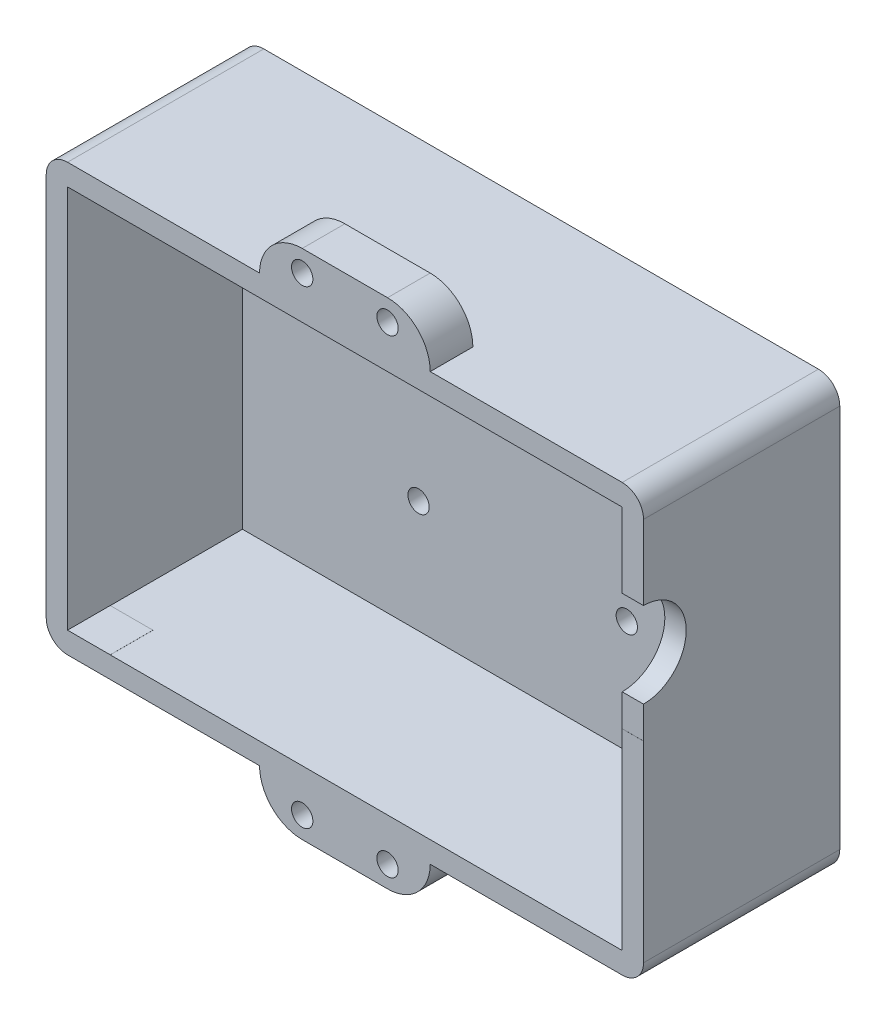
from build123d import *

# Parameters (mm, degrees)
SKETCH1_W            = 76.2
SKETCH1_H            = 63.5
BOSS_EXTRUDE1_DEPTH  = 31.75
SKETCH2_W            = 69.85
SKETCH2_H            = 57.15
CUT_EXTRUDE1_DEPTH   = 28.575
SKETCH3_W            = 19.05
SKETCH3_H            = 25.4
CUT_EXTRUDE2_DEPTH   = 28.575
SKETCH4_R            = 1.5875
SKETCH4_W            = 19.05
SKETCH4_H            = 6.35
CUT_EXTRUDE3_DEPTH   = 28.575
SKETCH5_W            = 19.05
SKETCH5_H            = 6.35
CUT_EXTRUDE4_DEPTH   = 28.575
SKETCH7_W            = 25.4
SKETCH7_H            = 6.35
BOSS_EXTRUDE2_DEPTH  = 6.35
SKETCH9_R            = 1.5875
CUT_EXTRUDE5_DEPTH   = 6.35
SKETCH10_W           = 25.4
SKETCH10_H           = 6.35
BOSS_EXTRUDE3_DEPTH  = 6.35
SKETCH11_R           = 1.5875
CUT_EXTRUDE6_DEPTH   = 6.35
SKETCH12_R           = 6.35
CUT_EXTRUDE8_DEPTH   = 6.35
SKETCH13_W           = 7.178118798
SKETCH13_H           = 13.595140403
BOSS_EXTRUDE4_DEPTH  = 3.175
SKETCH14_R           = 6.35
CUT_EXTRUDE9_DEPTH   = 3.175
SKETCH15_R           = 1.5875
BOSS_EXTRUDE8_DEPTH  = 3.175
SKETCH16_R           = 1.5875
CUT_EXTRUDE11_DEPTH  = 8.509
CUT_EXTRUDE12_DEPTH  = 8.509
SKETCH26_R           = 2.921
CUT_EXTRUDE24_DEPTH  = 72.898
SKETCH32_W           = 69.85
SKETCH32_H           = 57.15
SKETCH32_R           = 2.921
BOSS_EXTRUDE10_DEPTH = 5.715
SKETCH36_W           = 34.13125
SKETCH36_H           = 28.575
CUT_EXTRUDE27_DEPTH  = 38.227
CUT_EXTRUDE29_DEPTH  = 38.227
SKETCH39_W           = 17.907
SKETCH39_H           = 57.15
SKETCH39_R           = 1.905
SKETCH39_W_2         = 17.81175
BOSS_EXTRUDE11_DEPTH = 2.54
CUT_EXTRUDE34_DEPTH  = 11.176
SKETCH47_W           = 34.544
SKETCH47_H           = 45.212
CUT_EXTRUDE36_DEPTH  = 11.43
SKETCH51_W           = 31.75
SKETCH51_H           = 63.5
BOSS_EXTRUDE16_DEPTH = 6.35
SKETCH52_W           = 31.75
SKETCH52_H           = 63.5
BOSS_EXTRUDE17_DEPTH = 6.35
CUT_EXTRUDE37_START  = -6.35
SKETCH53_R           = 6.35
CUT_EXTRUDE37_DEPTH  = 6.35
SKETCH54_W           = 6.35
SKETCH54_H           = 57.013513642
SKETCH54_H_2         = 57.15
CUT_EXTRUDE38_DEPTH  = 21.59
SKETCH57_W           = 6.35
SKETCH57_H           = 57.15
BOSS_EXTRUDE20_DEPTH = 1.27
SKETCH59_W           = 16.847295719
SKETCH59_H           = 36.06156687
SKETCH59_W_2         = 16.70806187
SKETCH59_H_2         = 36.618502265
BOSS_EXTRUDE21_DEPTH = 11.43
SKETCH61_R           = 2.921
CUT_EXTRUDE39_DEPTH  = 8.89
SKETCH62_R           = 1.905
CUT_EXTRUDE40_DEPTH  = 2.54
SKETCH64_W           = 6.35
SKETCH64_H           = 20.32
CUT_EXTRUDE42_DEPTH  = 0.127
SKETCH63_W           = 1.27
SKETCH63_H           = 57.013513642
SKETCH63_W_2         = 3.81
BOSS_EXTRUDE22_DEPTH = 83.439
SKETCH65_R           = 1.5875
CUT_EXTRUDE43_DEPTH  = 83.439
SKETCH66_W           = 25.4
SKETCH66_H           = 38.1
CUT_EXTRUDE44_DEPTH  = 83.439
BOSS_EXTRUDE23_DEPTH = 11.43
CUT_EXTRUDE45_DEPTH  = 11.43
CUT_EXTRUDE47_DEPTH  = 63.5
SKETCH72_R           = 6.35
CUT_EXTRUDE48_DEPTH  = 63.5
SKETCH73_W           = 7.89440902
SKETCH73_H           = 12.7
BOSS_EXTRUDE24_DEPTH = 3.175
CUT_EXTRUDE49_DEPTH  = 9.779
CUT_EXTRUDE50_DEPTH  = 9.779
CUT_EXTRUDE51_DEPTH  = 9.779
SKETCH81_W           = 3.243342167
SKETCH81_H           = 0.034482981
CUT_EXTRUDE52_DEPTH  = 36.703
SKETCH85_R           = 2.921
CUT_EXTRUDE53_DEPTH  = 11.43
SKETCH86_W           = 82.55
SKETCH86_H           = 57.15
SKETCH86_R           = 1.905
BOSS_EXTRUDE28_DEPTH = 2.54
CUT_EXTRUDE54_START  = -38.862
SKETCH87_R           = 1.5875
SKETCH87_W           = 25.330152682
SKETCH87_H           = 38.1
CUT_EXTRUDE54_DEPTH  = 38.862
SKETCH88_W           = 34.544
SKETCH88_H           = 38.1
SKETCH88_W_2         = 31.147363918
SKETCH88_H_2         = 3.556
CUT_EXTRUDE55_DEPTH  = 2.54
CUT_EXTRUDE56_DEPTH  = 2.54
CUT_EXTRUDE57_DEPTH  = 2.54
BOSS_EXTRUDE30_START = -7.62
SKETCH92_W           = 82.55
SKETCH92_H           = 57.15
SKETCH92_R           = 1.5875
SKETCH92_W_2         = 25.4
SKETCH92_H_2         = 38.1
BOSS_EXTRUDE30_DEPTH = 7.62
SKETCH93_W           = 82.55
SKETCH93_H           = 57.15
CUT_EXTRUDE58_DEPTH  = 2.54
SKETCH94_W           = 82.55
SKETCH94_H           = 57.15
CUT_EXTRUDE59_DEPTH  = 32.004
SKETCH95_W           = 86.575346052
SKETCH95_H           = 60.338226315
BOSS_EXTRUDE31_DEPTH = 5.715
SKETCH96_W           = 93.509952632
SKETCH96_H           = 68.488176315
CUT_EXTRUDE60_DEPTH  = 2.54
CUT_EXTRUDE61_START  = -10.668
SKETCH97_R           = 6.35
CUT_EXTRUDE61_DEPTH  = 10.668
SKETCH98_W           = 10.458534211
SKETCH98_H           = 15.345159211
BOSS_EXTRUDE32_DEPTH = 3.175
SKETCH99_R           = 1.5875
CUT_EXTRUDE62_DEPTH  = 25.527
SKETCH100_W          = 8.061009101
SKETCH100_H          = 12.695256821
BOSS_EXTRUDE33_DEPTH = 3.175
SKETCH103_R          = 6.35
CUT_EXTRUDE63_DEPTH  = 3.175


with BuildPart() as part:
    # Sketch1 → Boss-Extrude1 (new body)
    with BuildSketch(Plane.XY):
        with Locations((38.1, -31.75)):
            Rectangle(SKETCH1_W, SKETCH1_H)
    extrude(amount=BOSS_EXTRUDE1_DEPTH)

    # Sketch2 → Cut-Extrude1 (cut)
    with BuildSketch(Plane.XY.offset(31.75)):
        with Locations((38.1, -31.75)):
            Rectangle(SKETCH2_W, SKETCH2_H)
    extrude(amount=-CUT_EXTRUDE1_DEPTH, mode=Mode.SUBTRACT)

    # Sketch3 → Cut-Extrude2 (cut)
    with BuildSketch(Plane(origin=(0, 0, 0), x_dir=(-1, 0, 0), z_dir=(0, 0, -1))):
        with Locations((-38.1, -31.75)):
            Rectangle(SKETCH3_W, SKETCH3_H)
    extrude(amount=-CUT_EXTRUDE2_DEPTH, mode=Mode.SUBTRACT)

    # Sketch4 → Cut-Extrude3 (cut)
    with BuildSketch(Plane(origin=(0, 0, 0), x_dir=(-1, 0, 0), z_dir=(0, 0, -1))):
        with Locations((-52.03825, -19.05)):
            Circle(SKETCH4_R)
        with Locations((-24.257, -19.05)):
            Circle(SKETCH4_R)
        with Locations((-52.038249991, -44.45)):
            Circle(SKETCH4_R)
        with Locations((-24.257, -44.45)):
            Circle(SKETCH4_R)
        with Locations((-38.1, -15.875)):
            Rectangle(SKETCH4_W, SKETCH4_H)
    extrude(amount=-CUT_EXTRUDE3_DEPTH, mode=Mode.SUBTRACT)

    # Sketch5 → Cut-Extrude4 (cut)
    with BuildSketch(Plane(origin=(0, 0, 0), x_dir=(-1, 0, 0), z_dir=(0, 0, -1))):
        with Locations((-38.1, -47.625)):
            Rectangle(SKETCH5_W, SKETCH5_H)
    extrude(amount=-CUT_EXTRUDE4_DEPTH, mode=Mode.SUBTRACT)

    # Sketch7 → Boss-Extrude2 (add)
    with BuildSketch(Plane(origin=(0, 0, 0), x_dir=(1, 0, 0), z_dir=(0, 1, 0))):
        with Locations((38.1, -28.575)):
            Rectangle(SKETCH7_W, SKETCH7_H)
    extrude(amount=BOSS_EXTRUDE2_DEPTH)

    # Sketch9 → Cut-Extrude5 (cut)
    with BuildSketch(Plane(origin=(0, 0, 25.4), x_dir=(-1, 0, 0), z_dir=(0, 0, -1))):
        with Locations((-44.45, 3.175)):
            Circle(SKETCH9_R)
        with Locations((-31.75, 3.175)):
            Circle(SKETCH9_R)
    extrude(amount=-CUT_EXTRUDE5_DEPTH, mode=Mode.SUBTRACT)

    # Sketch10 → Boss-Extrude3 (add)
    with BuildSketch(Plane.XZ.offset(63.5)):
        with Locations((38.1, 28.575)):
            Rectangle(SKETCH10_W, SKETCH10_H)
    extrude(amount=BOSS_EXTRUDE3_DEPTH)

    # Sketch11 → Cut-Extrude6 (cut)
    with BuildSketch(Plane(origin=(0, 0, 25.4), x_dir=(-1, 0, 0), z_dir=(0, 0, -1))):
        with Locations((-44.45, -66.675)):
            Circle(SKETCH11_R)
        with Locations((-31.75, -66.675)):
            Circle(SKETCH11_R)
    extrude(amount=-CUT_EXTRUDE6_DEPTH, mode=Mode.SUBTRACT)

    # Sketch12 → Cut-Extrude8 (cut)
    with BuildSketch(Plane(origin=(76.2, 0, 0), x_dir=(0, 0, -1), z_dir=(1, 0, 0))):
        with Locations((-31.75, -28.575)):
            Circle(SKETCH12_R)
    extrude(amount=-CUT_EXTRUDE8_DEPTH, mode=Mode.SUBTRACT)

    # Sketch13 → Boss-Extrude4 (add)
    with BuildSketch(Plane(origin=(76.2, 0, 0), x_dir=(0, 0, -1), z_dir=(1, 0, 0))):
        with Locations((-28.160940601, -29.022570202)):
            Rectangle(SKETCH13_W, SKETCH13_H)
    extrude(amount=-BOSS_EXTRUDE4_DEPTH)

    # Sketch14 → Cut-Extrude9 (cut)
    with BuildSketch(Plane(origin=(76.2, 0, 0), x_dir=(0, 0, -1), z_dir=(1, 0, 0))):
        with Locations((-31.75, -25.4)):
            Circle(SKETCH14_R)
    extrude(amount=-CUT_EXTRUDE9_DEPTH, mode=Mode.SUBTRACT)

    # Sketch15 → Boss-Extrude8 (add)
    with BuildSketch(Plane(origin=(0, 0, 0), x_dir=(-1, 0, 0), z_dir=(0, 0, -1))):
        with Locations((-52.03825, -19.05)):
            Circle(SKETCH15_R)
        with Locations((-24.257, -19.05)):
            Circle(SKETCH15_R)
        with Locations((-24.257, -44.45)):
            Circle(SKETCH15_R)
        with Locations((-52.038249991, -44.45)):
            Circle(SKETCH15_R)
    extrude(amount=-BOSS_EXTRUDE8_DEPTH)

    # Sketch16 → Cut-Extrude11 (cut)
    with BuildSketch(Plane(origin=(0, 0, 0), x_dir=(-1, 0, 0), z_dir=(0, 0, -1))):
        with Locations((-53.62575, -19.05)):
            Circle(SKETCH16_R)
        with Locations((-53.625749991, -44.45)):
            Circle(SKETCH16_R)
        with Locations((-22.6695, -19.05)):
            Circle(SKETCH16_R)
        with Locations((-22.6695, -44.45)):
            Circle(SKETCH16_R)
    extrude(amount=-CUT_EXTRUDE11_DEPTH, mode=Mode.SUBTRACT)

    # Sketch18 → Cut-Extrude12 (cut)
    with BuildSketch(Plane(origin=(0, 0, 0), x_dir=(-1, 0, 0), z_dir=(0, 0, -1))):
        with BuildLine():
            Line((-50.109634686, -12.7), (-47.625, -12.7))
            Line((-47.625, -12.7), (-26.090365314, -12.7))
            ThreePointArc((-26.090365314, -12.7), (-26.818097964, -10.943097964), (-28.575, -10.215365314))
            Line((-28.575, -10.215365314), (-47.625, -10.215365314))
            ThreePointArc((-47.625, -10.215365314), (-49.381902036, -10.943097964), (-50.109634686, -12.7))
        make_face()
    extrude(amount=-CUT_EXTRUDE12_DEPTH, mode=Mode.SUBTRACT)

    # Sketch26 → Cut-Extrude24 (cut)
    with BuildSketch(Plane(origin=(0, 0, 0), x_dir=(-1, 0, 0), z_dir=(0, 0, -1))):
        with Locations((-68.58, -31.75)):
            Circle(SKETCH26_R)
        with Locations((-64.77, -25.4)):
            Circle(SKETCH26_R)
        with Locations((-60.96, -19.05)):
            Circle(SKETCH26_R)
        with Locations((-64.77, -38.1)):
            Circle(SKETCH26_R)
        with Locations((-60.96, -44.45)):
            Circle(SKETCH26_R)
        with Locations((-7.62, -31.75)):
            Circle(SKETCH26_R)
        with Locations((-11.43, -25.4)):
            Circle(SKETCH26_R)
        with Locations((-15.24, -19.05)):
            Circle(SKETCH26_R)
        with Locations((-11.43, -38.1)):
            Circle(SKETCH26_R)
        with Locations((-15.24, -44.45)):
            Circle(SKETCH26_R)
    extrude(amount=-CUT_EXTRUDE24_DEPTH, mode=Mode.SUBTRACT)

    # Sketch32 → Boss-Extrude10 (add)
    with BuildSketch(Plane.XY.offset(3.175)):
        with Locations((38.1, -31.75)):
            Rectangle(SKETCH32_W, SKETCH32_H)
        with Locations(Location((15.24, -19.05, 0), (0, 0, 180))):
            Circle(SKETCH32_R, mode=Mode.SUBTRACT)
        with Locations(Location((11.43, -25.4, 0), (0, 0, 180))):
            Circle(SKETCH32_R, mode=Mode.SUBTRACT)
        with Locations(Location((7.62, -31.75, 0), (0, 0, 180))):
            Circle(SKETCH32_R, mode=Mode.SUBTRACT)
        with Locations(Location((11.43, -38.1, 0), (0, 0, 180))):
            Circle(SKETCH32_R, mode=Mode.SUBTRACT)
        with Locations(Location((15.24, -44.45, 0), (0, 0, 180))):
            Circle(SKETCH32_R, mode=Mode.SUBTRACT)
        with Locations(Location((60.96, -44.45, 0), (0, 0, 180))):
            Circle(SKETCH32_R, mode=Mode.SUBTRACT)
        with Locations(Location((64.77, -38.1, 0), (0, 0, 180))):
            Circle(SKETCH32_R, mode=Mode.SUBTRACT)
        with Locations(Location((68.58, -31.75, 0), (0, 0, 180))):
            Circle(SKETCH32_R, mode=Mode.SUBTRACT)
        with Locations(Location((64.77, -25.4, 0), (0, 0, 180))):
            Circle(SKETCH32_R, mode=Mode.SUBTRACT)
        with Locations(Location((60.96, -19.05, 0), (0, 0, 180))):
            Circle(SKETCH32_R, mode=Mode.SUBTRACT)
    extrude(amount=BOSS_EXTRUDE10_DEPTH)

    # Sketch36 → Cut-Extrude27 (cut)
    with BuildSketch(Plane(origin=(0, 0, 0), x_dir=(-1, 0, 0), z_dir=(0, 0, -1))):
        with Locations((-38.147625, -31.75)):
            Rectangle(SKETCH36_W, SKETCH36_H)
    extrude(amount=-CUT_EXTRUDE27_DEPTH, mode=Mode.SUBTRACT)

    # Sketch38 → Cut-Extrude29 (cut)
    with BuildSketch(Plane(origin=(0, 0, 0), x_dir=(-1, 0, 0), z_dir=(0, 0, -1))):
        with BuildLine():
            Line((-55.21325, -46.0375), (-21.082, -46.0375))
            add(Edge.make_bspline(
                [(-55.21325, -46.0375), (-46.324674136, -54.645526768), (-29.935856485, -54.748655934), (-21.082, -46.0375)],
                knots=[0, 0, 0, 0, 1, 1, 1, 1], degree=3))
        make_face()
    extrude(amount=-CUT_EXTRUDE29_DEPTH, mode=Mode.SUBTRACT)

    # Sketch39 → Boss-Extrude11 (add)
    # profile 1 of 2: a face of its own
    with BuildSketch(Plane.XY.offset(8.89)):
        with Locations((12.1285, -31.75)):
            Rectangle(SKETCH39_W, SKETCH39_H)
        with Locations((15.24, -19.05)):
            Circle(SKETCH39_R, mode=Mode.SUBTRACT)
        with Locations((11.43, -25.4)):
            Circle(SKETCH39_R, mode=Mode.SUBTRACT)
        with Locations((7.62, -31.75)):
            Circle(SKETCH39_R, mode=Mode.SUBTRACT)
        with Locations((11.43, -38.1)):
            Circle(SKETCH39_R, mode=Mode.SUBTRACT)
        with Locations((15.24, -44.45)):
            Circle(SKETCH39_R, mode=Mode.SUBTRACT)
    # profile 2 of 2: a face of its own
    with BuildSketch(Plane.XY.offset(8.89)):
        with Locations((64.119125, -31.75)):
            Rectangle(SKETCH39_W_2, SKETCH39_H)
        with Locations((60.96, -44.45)):
            Circle(SKETCH39_R, mode=Mode.SUBTRACT)
        with Locations((64.77, -38.1)):
            Circle(SKETCH39_R, mode=Mode.SUBTRACT)
        with Locations((68.58, -31.75)):
            Circle(SKETCH39_R, mode=Mode.SUBTRACT)
        with Locations((64.77, -25.4)):
            Circle(SKETCH39_R, mode=Mode.SUBTRACT)
        with Locations((60.96, -19.05)):
            Circle(SKETCH39_R, mode=Mode.SUBTRACT)
    extrude(amount=BOSS_EXTRUDE11_DEPTH)

    # Sketch44 → Cut-Extrude34 (cut)
    with BuildSketch(Plane(origin=(0, 0, 0), x_dir=(-1, 0, 0), z_dir=(0, 0, -1))):
        with BuildLine():
            Line((-47.625, -9.87425), (-28.575, -9.9695))
            ThreePointArc((-28.575, -9.9695), (-23.276648889, -12.164148889), (-21.082, -17.4625))
            Line((-21.082, -17.4625), (-55.21325, -17.4625))
            ThreePointArc((-55.21325, -17.4625), (-52.990703032, -12.096796968), (-47.625, -9.87425))
        make_face()
    extrude(amount=-CUT_EXTRUDE34_DEPTH, mode=Mode.SUBTRACT)

    # Sketch47 → Cut-Extrude36 (cut)
    with BuildSketch(Plane(origin=(0, 0, 0), x_dir=(-1, 0, 0), z_dir=(0, 0, -1))):
        with Locations((-38.1, -31.75)):
            Rectangle(SKETCH47_W, SKETCH47_H)
    extrude(amount=-CUT_EXTRUDE36_DEPTH, mode=Mode.SUBTRACT)

    # Sketch51 → Boss-Extrude16 (add)
    with BuildSketch(Plane(origin=(76.2, 0, 0), x_dir=(0, 0, -1), z_dir=(1, 0, 0))):
        with Locations((-15.875, -31.75)):
            Rectangle(SKETCH51_W, SKETCH51_H)
    extrude(amount=BOSS_EXTRUDE16_DEPTH)

    # Sketch52 → Boss-Extrude17 (add)
    with BuildSketch(Plane.ZY):
        with Locations((15.875, -31.75)):
            Rectangle(SKETCH52_W, SKETCH52_H)
    extrude(amount=BOSS_EXTRUDE17_DEPTH)

    # Sketch53 → Cut-Extrude37 (cut)
    with BuildSketch(Plane.ZY.offset(-76.2).offset(CUT_EXTRUDE37_START)):
        with Locations((31.75, -25.4)):
            Circle(SKETCH53_R)
    extrude(amount=CUT_EXTRUDE37_DEPTH, mode=Mode.SUBTRACT)

    # Sketch54 → Cut-Extrude38 (cut)
    with BuildSketch(Plane.XY.offset(31.75)):
        with Locations((0, -31.681756821)):
            Rectangle(SKETCH54_W, SKETCH54_H)
        with Locations((76.2, -31.75)):
            Rectangle(SKETCH54_W, SKETCH54_H_2)
    extrude(amount=-CUT_EXTRUDE38_DEPTH, mode=Mode.SUBTRACT)

    # Sketch57 → Boss-Extrude20 (add)
    with BuildSketch(Plane.XY.offset(10.16)):
        with Locations((0, -31.75)):
            Rectangle(SKETCH57_W, SKETCH57_H)
        with Locations((76.2, -31.75)):
            Rectangle(SKETCH57_W, SKETCH57_H)
    extrude(amount=BOSS_EXTRUDE20_DEPTH)

    # Sketch59 → Boss-Extrude21 (add)
    with BuildSketch(Plane(origin=(0, 0, 0), x_dir=(-1, 0, 0), z_dir=(0, 0, -1))):
        with Locations((-64.972132842, -31.43672384)):
            Rectangle(SKETCH59_W, SKETCH59_H)
        with Locations((-10.810165612, -30.601320747)):
            Rectangle(SKETCH59_W_2, SKETCH59_H_2)
    extrude(amount=-BOSS_EXTRUDE21_DEPTH)

    # Sketch61 → Cut-Extrude39 (cut)
    with BuildSketch(Plane(origin=(0, 0, 0), x_dir=(-1, 0, 0), z_dir=(0, 0, -1))):
        with Locations((-74.93, -31.75)):
            Circle(SKETCH61_R)
        with Locations((-71.12, -25.4)):
            Circle(SKETCH61_R)
        with Locations((73.743865323, -27.677409919)):
            Circle(SKETCH61_R)
        with Locations((-67.31, -19.05)):
            Circle(SKETCH61_R)
        with Locations((-71.12, -38.1)):
            Circle(SKETCH61_R)
        with Locations((-67.31, -44.45)):
            Circle(SKETCH61_R)
        with Locations((-1.27, -31.75)):
            Circle(SKETCH61_R)
        with Locations((-5.08, -25.4)):
            Circle(SKETCH61_R)
        with Locations((-8.89, -19.05)):
            Circle(SKETCH61_R)
        with Locations((-5.08, -38.1)):
            Circle(SKETCH61_R)
        with Locations((-8.89, -44.45)):
            Circle(SKETCH61_R)
    extrude(amount=-CUT_EXTRUDE39_DEPTH, mode=Mode.SUBTRACT)

    # Sketch62 → Cut-Extrude40 (cut)
    with BuildSketch(Plane(origin=(0, 0, 8.89), x_dir=(-1, 0, 0), z_dir=(0, 0, -1))):
        with Locations((-67.31, -19.05)):
            Circle(SKETCH62_R)
        with Locations((-71.12, -25.4)):
            Circle(SKETCH62_R)
        with Locations((-74.93, -31.75)):
            Circle(SKETCH62_R)
        with Locations((-71.12, -38.1)):
            Circle(SKETCH62_R)
        with Locations((-67.31, -44.45)):
            Circle(SKETCH62_R)
        with Locations((-8.89, -44.45)):
            Circle(SKETCH62_R)
        with Locations((-5.08, -38.1)):
            Circle(SKETCH62_R)
        with Locations((-1.27, -31.75)):
            Circle(SKETCH62_R)
        with Locations((-5.08, -25.4)):
            Circle(SKETCH62_R)
        with Locations((-8.89, -19.05)):
            Circle(SKETCH62_R)
    extrude(amount=-CUT_EXTRUDE40_DEPTH, mode=Mode.SUBTRACT)

    # Sketch64 → Cut-Extrude42 (cut)
    with BuildSketch(Plane(origin=(0, -60.188513642, 0), x_dir=(1, 0, 0), z_dir=(0, 1, 0))):
        with Locations((0, -21.59)):
            Rectangle(SKETCH64_W, SKETCH64_H)
    extrude(amount=-CUT_EXTRUDE42_DEPTH, mode=Mode.SUBTRACT)

    # Sketch63 → Boss-Extrude22 (add)
    with BuildSketch(Plane(origin=(-3.175, 0, 0), x_dir=(0, 0, -1), z_dir=(1, 0, 0))):
        with Locations((-20.955, -31.681756821)):
            Rectangle(SKETCH63_W, SKETCH63_H)
        with Locations((-23.495, -31.681756821)):
            Rectangle(SKETCH63_W_2, SKETCH63_H)
    extrude(amount=BOSS_EXTRUDE22_DEPTH)

    # Sketch65 → Cut-Extrude43 (cut)
    with BuildSketch(Plane(origin=(0, 0, 0), x_dir=(-1, 0, 0), z_dir=(0, 0, -1))):
        with Locations(Location((-53.594, -19.05, 0), (0, 0, 90))):
            Circle(SKETCH65_R)
        with Locations(Location((-22.606, -19.05, 0), (0, 0, 90))):
            Circle(SKETCH65_R)
        with Locations(Location((-22.606, -44.45, 0), (0, 0, 90))):
            Circle(SKETCH65_R)
        with Locations(Location((-53.594, -44.45, 0), (0, 0, 90))):
            Circle(SKETCH65_R)
    extrude(amount=-CUT_EXTRUDE43_DEPTH, mode=Mode.SUBTRACT)

    # Sketch66 → Cut-Extrude44 (cut)
    with BuildSketch(Plane(origin=(0, 0, 20.32), x_dir=(-1, 0, 0), z_dir=(0, 0, -1))):
        with Locations((-38.1, -31.75)):
            Rectangle(SKETCH66_W, SKETCH66_H)
    extrude(amount=-CUT_EXTRUDE44_DEPTH, mode=Mode.SUBTRACT)

    # Sketch67 → Boss-Extrude23 (add)
    with BuildSketch(Plane(origin=(0, 0, 0), x_dir=(-1, 0, 0), z_dir=(0, 0, -1))):
        with BuildLine():
            Line((-53.673681959, -9.144), (-55.372, -9.144))
            Line((-55.372, -9.144), (-55.372, -12.7))
            ThreePointArc((-55.372, -12.7), (-54.925630735, -10.729630735), (-53.673681959, -9.144))
        make_face()
        with BuildLine():
            Line((-55.372, -50.8), (-55.372, -54.356))
            Line((-55.372, -54.356), (-53.673681959, -54.356))
            ThreePointArc((-53.673681959, -54.356), (-54.925630735, -52.770369265), (-55.372, -50.8))
        make_face()
        with BuildLine():
            Line((-22.526318041, -54.356), (-20.828, -54.356))
            Line((-20.828, -54.356), (-20.828, -50.8))
            ThreePointArc((-20.828, -50.8), (-21.274369265, -52.770369265), (-22.526318041, -54.356))
        make_face()
        with BuildLine():
            Line((-20.828, -12.7), (-20.828, -9.144))
            Line((-20.828, -9.144), (-22.526318041, -9.144))
            ThreePointArc((-22.526318041, -9.144), (-21.274369265, -10.729630735), (-20.828, -12.7))
        make_face()
    extrude(amount=-BOSS_EXTRUDE23_DEPTH)

    # Sketch68 → Cut-Extrude45 (cut)
    with BuildSketch(Plane(origin=(0, 0, 20.32), x_dir=(-1, 0, 0), z_dir=(0, 0, -1))):
        Polygon((-67.31, -17.145), (-65.405, -19.05), (-73.025, -31.75), (-65.405, -44.45), (-67.31, -46.355), (-76.835, -31.75), align=None)
        Polygon((-10.795, -19.05), (-8.89, -17.145), (0.635, -31.75), (-8.89, -46.355), (-10.795, -44.45), (-3.175, -31.75), align=None)
    extrude(amount=-CUT_EXTRUDE45_DEPTH, mode=Mode.SUBTRACT)

    # Sketch71 → Cut-Extrude47 (cut)
    with BuildSketch(Plane.XY.offset(31.75)):
        with BuildLine():
            Line((-3.175, 0), (-6.35, 0))
            Line((-6.35, 0), (-6.35, -3.175))
            ThreePointArc((-6.35, -3.175), (-5.42006403, -0.92993597), (-3.175, 0))
        make_face()
        with BuildLine():
            Line((-6.35, -60.315513642), (-6.35, -63.5))
            Line((-6.35, -63.5), (-3.175, -63.490513642))
            ThreePointArc((-3.175, -63.490513642), (-5.42006403, -62.560577672), (-6.35, -60.315513642))
        make_face()
        with BuildLine():
            Line((82.55, -60.325), (82.55, -63.5))
            Line((82.55, -63.5), (79.375, -63.5))
            ThreePointArc((79.375, -63.5), (81.62006403, -62.57006403), (82.55, -60.325))
        make_face()
        with BuildLine():
            Line((79.375, 0), (82.55, 0))
            Line((82.55, 0), (82.55, -3.175))
            ThreePointArc((82.55, -3.175), (81.62006403, -0.92993597), (79.375, 0))
        make_face()
    extrude(amount=-CUT_EXTRUDE47_DEPTH, mode=Mode.SUBTRACT)

    # Sketch72 → Cut-Extrude48 (cut)
    with BuildSketch(Plane(origin=(-3.175, 0, 0), x_dir=(0, 0, -1), z_dir=(1, 0, 0))):
        with Locations((-31.75, -25.4)):
            Circle(SKETCH72_R)
    extrude(amount=-CUT_EXTRUDE48_DEPTH, mode=Mode.SUBTRACT)

    # Sketch73 → Boss-Extrude24 (add)
    with BuildSketch(Plane(origin=(82.55, 0, 0), x_dir=(0, 0, -1), z_dir=(1, 0, 0))):
        with Locations((-27.80279549, -25.4)):
            Rectangle(SKETCH73_W, SKETCH73_H)
    extrude(amount=-BOSS_EXTRUDE24_DEPTH)

    # Sketch74 → Cut-Extrude49 (cut)
    with BuildSketch(Plane(origin=(0, 0, 25.4), x_dir=(-1, 0, 0), z_dir=(0, 0, -1))):
        with BuildLine():
            Line((-44.45, 6.35), (-50.8, 6.35))
            Line((-50.8, 6.35), (-50.8, 0))
            ThreePointArc((-50.8, 0), (-48.940128061, 4.490128061), (-44.45, 6.35))
        make_face()
        with BuildLine():
            Line((-31.75, 6.35), (-25.4, 6.35))
            Line((-25.4, 6.35), (-25.4, 0))
            ThreePointArc((-25.4, 0), (-27.259871939, 4.490128061), (-31.75, 6.35))
        make_face()
    extrude(amount=-CUT_EXTRUDE49_DEPTH, mode=Mode.SUBTRACT)

    # Sketch75 → Cut-Extrude50 (cut)
    with BuildSketch(Plane(origin=(0, 0, 25.4), x_dir=(-1, 0, 0), z_dir=(0, 0, -1))):
        with BuildLine():
            Line((-50.8, -63.5), (-50.8, -69.85))
            Line((-50.8, -69.85), (-44.45, -69.85))
            ThreePointArc((-44.45, -69.85), (-48.940128061, -67.990128061), (-50.8, -63.5))
        make_face()
        with BuildLine():
            Line((-31.75, -69.85), (-25.4, -69.85))
            Line((-25.4, -69.85), (-25.4, -63.5))
            ThreePointArc((-25.4, -63.5), (-27.259871939, -67.990128061), (-31.75, -69.85))
        make_face()
    extrude(amount=-CUT_EXTRUDE50_DEPTH, mode=Mode.SUBTRACT)

    # Sketch76 → Cut-Extrude51 (cut)
    with BuildSketch(Plane(origin=(0, 0, 20.32), x_dir=(-1, 0, 0), z_dir=(0, 0, -1))):
        Polygon((-67.31, -16.129), (-64.389, -19.05), (-72.009, -31.75), (-64.389, -44.45), (-67.31, -47.371), (-77.851, -31.75), align=None)
        Polygon((-11.811, -19.05), (-8.89, -16.129), (1.651, -31.75), (-7.515411765, -47.027352941), (-11.811, -44.45), (-4.191, -31.75), align=None)
    extrude(amount=-CUT_EXTRUDE51_DEPTH, mode=Mode.SUBTRACT)

    # Sketch81 → Cut-Extrude52 (cut)
    with BuildSketch(Plane.XY.offset(31.75)):
        with Locations((-4.796671084, -63.507755133)):
            Rectangle(SKETCH81_W, SKETCH81_H)
    extrude(amount=-CUT_EXTRUDE52_DEPTH, mode=Mode.SUBTRACT)

    # Sketch85 → Cut-Extrude53 (cut)
    with BuildSketch(Plane(origin=(0, 0, 0), x_dir=(-1, 0, 0), z_dir=(0, 0, -1))):
        with Locations((-67.31, -19.05)):
            Circle(SKETCH85_R)
        with Locations((-71.12, -25.4)):
            Circle(SKETCH85_R)
        with Locations((-74.93, -31.75)):
            Circle(SKETCH85_R)
        with Locations((-71.12, -38.1)):
            Circle(SKETCH85_R)
        with Locations((-67.31, -44.45)):
            Circle(SKETCH85_R)
        with Locations((-8.89, -44.45)):
            Circle(SKETCH85_R)
        with Locations((-5.08, -38.1)):
            Circle(SKETCH85_R)
        with Locations((-1.27, -31.75)):
            Circle(SKETCH85_R)
        with Locations((-5.08, -25.4)):
            Circle(SKETCH85_R)
        with Locations((-8.89, -19.05)):
            Circle(SKETCH85_R)
    extrude(amount=-CUT_EXTRUDE53_DEPTH, mode=Mode.SUBTRACT)

    # Sketch86 → Boss-Extrude28 (add)
    with BuildSketch(Plane.XY.offset(11.43)):
        with Locations((38.1, -31.75)):
            Rectangle(SKETCH86_W, SKETCH86_H)
        with Locations((5.08, -25.4)):
            Circle(SKETCH86_R, mode=Mode.SUBTRACT)
        with Locations((8.89, -19.05)):
            Circle(SKETCH86_R, mode=Mode.SUBTRACT)
        with Locations((1.27, -31.75)):
            Circle(SKETCH86_R, mode=Mode.SUBTRACT)
        with Locations((5.08, -38.1)):
            Circle(SKETCH86_R, mode=Mode.SUBTRACT)
        with Locations((8.89, -44.45)):
            Circle(SKETCH86_R, mode=Mode.SUBTRACT)
        with Locations((67.31, -19.05)):
            Circle(SKETCH86_R, mode=Mode.SUBTRACT)
        with Locations((71.12, -25.4)):
            Circle(SKETCH86_R, mode=Mode.SUBTRACT)
        with Locations((74.93, -31.75)):
            Circle(SKETCH86_R, mode=Mode.SUBTRACT)
        with Locations((71.12, -38.1)):
            Circle(SKETCH86_R, mode=Mode.SUBTRACT)
        with Locations((67.31, -44.45)):
            Circle(SKETCH86_R, mode=Mode.SUBTRACT)
    extrude(amount=BOSS_EXTRUDE28_DEPTH)

    # Sketch87 → Cut-Extrude54 (cut)
    with BuildSketch(Plane.XY.offset(25.4).offset(CUT_EXTRUDE54_START)):
        with Locations(Location((22.606, -19.05, 0), (0, 0, 90))):
            Circle(SKETCH87_R)
        with Locations(Location((53.594, -19.05, 0), (0, 0, 90))):
            Circle(SKETCH87_R)
        with Locations(Location((53.594, -44.45, 0), (0, 0, 90))):
            Circle(SKETCH87_R)
        with Locations(Location((22.606, -44.45, 0), (0, 0, 90))):
            Circle(SKETCH87_R)
        with Locations((38.134923659, -31.75)):
            Rectangle(SKETCH87_W, SKETCH87_H)
    extrude(amount=CUT_EXTRUDE54_DEPTH, mode=Mode.SUBTRACT)

    # Sketch88 → Cut-Extrude55 (cut)
    with BuildSketch(Plane(origin=(0, 0, 11.43), x_dir=(-1, 0, 0), z_dir=(0, 0, -1))):
        with Locations((-38.1, -31.75)):
            Rectangle(SKETCH88_W, SKETCH88_H)
        with Locations((-38.1, -10.922)):
            Rectangle(SKETCH88_W_2, SKETCH88_H_2)
        with Locations((-38.1, -52.578)):
            Rectangle(SKETCH88_W_2, SKETCH88_H_2)
    extrude(amount=-CUT_EXTRUDE55_DEPTH, mode=Mode.SUBTRACT)

    # Sketch89 → Cut-Extrude56 (cut)
    with BuildSketch(Plane(origin=(0, 0, 11.43), x_dir=(-1, 0, 0), z_dir=(0, 0, -1))):
        with BuildLine():
            Line((-53.673681959, -9.144), (-22.526318041, -9.144))
            ThreePointArc((-22.526318041, -9.144), (-21.274369265, -10.729630735), (-20.828, -12.7))
            Line((-20.828, -12.7), (-20.828, -50.8))
            ThreePointArc((-20.828, -50.8), (-21.274369265, -52.770369265), (-22.526318041, -54.356))
            Line((-22.526318041, -54.356), (-53.673681959, -54.356))
            ThreePointArc((-53.673681959, -54.356), (-54.925630735, -52.770369265), (-55.372, -50.8))
            Line((-55.372, -50.8), (-55.372, -12.7))
            ThreePointArc((-55.372, -12.7), (-54.925630735, -10.729630735), (-53.673681959, -9.144))
        make_face()
    extrude(amount=-CUT_EXTRUDE56_DEPTH, mode=Mode.SUBTRACT)

    # Sketch90 → Cut-Extrude57 (cut)
    with BuildSketch(Plane(origin=(0, 0, 0), x_dir=(-1, 0, 0), z_dir=(0, 0, -1))):
        Polygon((-80.854247125, -31.75), (-67.764275503, -9.933380631), (-59.052147378, -15.160657506), (-69.005752875, -31.75), (-58.709839267, -48.909856012), (-67.421967393, -54.137132887), align=None)
        Polygon((-8.48679721, -9.848259441), (4.654247125, -31.75), (-8.700940884, -54.008646683), (-17.224988151, -48.46790171), (-7.194247125, -31.75), (-17.156499501, -15.14624604), align=None)
    extrude(amount=-CUT_EXTRUDE57_DEPTH, mode=Mode.SUBTRACT)

    # Sketch92 → Boss-Extrude30 (add)
    with BuildSketch(Plane.XY.offset(25.4).offset(BOSS_EXTRUDE30_START)):
        with Locations((38.1, -31.75)):
            Rectangle(SKETCH92_W, SKETCH92_H)
        with Locations(Location((22.606, -19.05, 0), (0, 0, 90))):
            Circle(SKETCH92_R, mode=Mode.SUBTRACT)
        with Locations(Location((53.594, -19.05, 0), (0, 0, 90))):
            Circle(SKETCH92_R, mode=Mode.SUBTRACT)
        with Locations(Location((53.594, -44.45, 0), (0, 0, 90))):
            Circle(SKETCH92_R, mode=Mode.SUBTRACT)
        with Locations(Location((22.606, -44.45, 0), (0, 0, 90))):
            Circle(SKETCH92_R, mode=Mode.SUBTRACT)
        Polygon((8.89, -16.129), (-1.651, -31.75), (7.515411765, -47.027352941), (11.811, -44.45), (4.191, -31.75), (11.811, -19.05), align=None, mode=Mode.SUBTRACT)
        Polygon((67.31, -16.129), (77.851, -31.75), (67.31, -47.371), (64.389, -44.45), (72.009, -31.75), (64.389, -19.05), align=None, mode=Mode.SUBTRACT)
        with Locations((38.1, -31.75)):
            Rectangle(SKETCH92_W_2, SKETCH92_H_2, mode=Mode.SUBTRACT)
    extrude(amount=BOSS_EXTRUDE30_DEPTH)

    # Sketch93 → Cut-Extrude58 (cut)
    with BuildSketch(Plane.XY.offset(25.4)):
        with Locations((38.1, -31.75)):
            Rectangle(SKETCH93_W, SKETCH93_H)
    extrude(amount=-CUT_EXTRUDE58_DEPTH, mode=Mode.SUBTRACT)

    # Sketch94 → Cut-Extrude59 (cut)
    with BuildSketch(Plane.XY.offset(22.86)):
        with Locations((38.1, -31.75)):
            Rectangle(SKETCH94_W, SKETCH94_H)
    extrude(amount=-CUT_EXTRUDE59_DEPTH, mode=Mode.SUBTRACT)

    # Sketch95 → Boss-Extrude31 (add)
    with BuildSketch(Plane(origin=(0, 0, 0), x_dir=(-1, 0, 0), z_dir=(0, 0, -1))):
        with Locations((-38.207236184, -31.392546053)):
            Rectangle(SKETCH95_W, SKETCH95_H)
    extrude(amount=-BOSS_EXTRUDE31_DEPTH)

    # Sketch96 → Cut-Extrude60 (cut)
    with BuildSketch(Plane(origin=(0, 0, 0), x_dir=(-1, 0, 0), z_dir=(0, 0, -1))):
        with Locations((-38.242981579, -31.82149079)):
            Rectangle(SKETCH96_W, SKETCH96_H)
    extrude(amount=-CUT_EXTRUDE60_DEPTH, mode=Mode.SUBTRACT)

    # Sketch97 → Cut-Extrude61 (cut)
    with BuildSketch(Plane.ZY.offset(-79.375).offset(CUT_EXTRUDE61_START)):
        with Locations((31.75, -25.4)):
            Circle(SKETCH97_R)
    extrude(amount=CUT_EXTRUDE61_DEPTH, mode=Mode.SUBTRACT)

    # Sketch98 → Boss-Extrude32 (add)
    with BuildSketch(Plane.ZY.offset(6.35)):
        with Locations((26.520732895, -26.722579606)):
            Rectangle(SKETCH98_W, SKETCH98_H)
    extrude(amount=-BOSS_EXTRUDE32_DEPTH)

    # Sketch99 → Cut-Extrude62 (cut)
    with BuildSketch(Plane(origin=(0, 0, 2.54), x_dir=(-1, 0, 0), z_dir=(0, 0, -1))):
        with Locations((-54.022944737, -18.192110526)):
            Circle(SKETCH99_R)
        with Locations((-23.034944737, -18.192110526)):
            Circle(SKETCH99_R)
        with Locations((-23.034944737, -43.592110526)):
            Circle(SKETCH99_R)
        with Locations((-54.022944737, -43.592110526)):
            Circle(SKETCH99_R)
    extrude(amount=-CUT_EXTRUDE62_DEPTH, mode=Mode.SUBTRACT)

    # Sketch100 → Boss-Extrude33 (add)
    with BuildSketch(Plane(origin=(82.55, 0, 0), x_dir=(0, 0, -1), z_dir=(1, 0, 0))):
        with Locations((-27.71949545, -25.397628411)):
            Rectangle(SKETCH100_W, SKETCH100_H)
    extrude(amount=-BOSS_EXTRUDE33_DEPTH)

    # Sketch103 → Cut-Extrude63 (cut)
    with BuildSketch(Plane(origin=(82.55, 0, 0), x_dir=(0, 0, -1), z_dir=(1, 0, 0))):
        with Locations((-31.75, -20.6375)):
            Circle(SKETCH103_R)
    extrude(amount=-CUT_EXTRUDE63_DEPTH, mode=Mode.SUBTRACT)


solid = part.part
